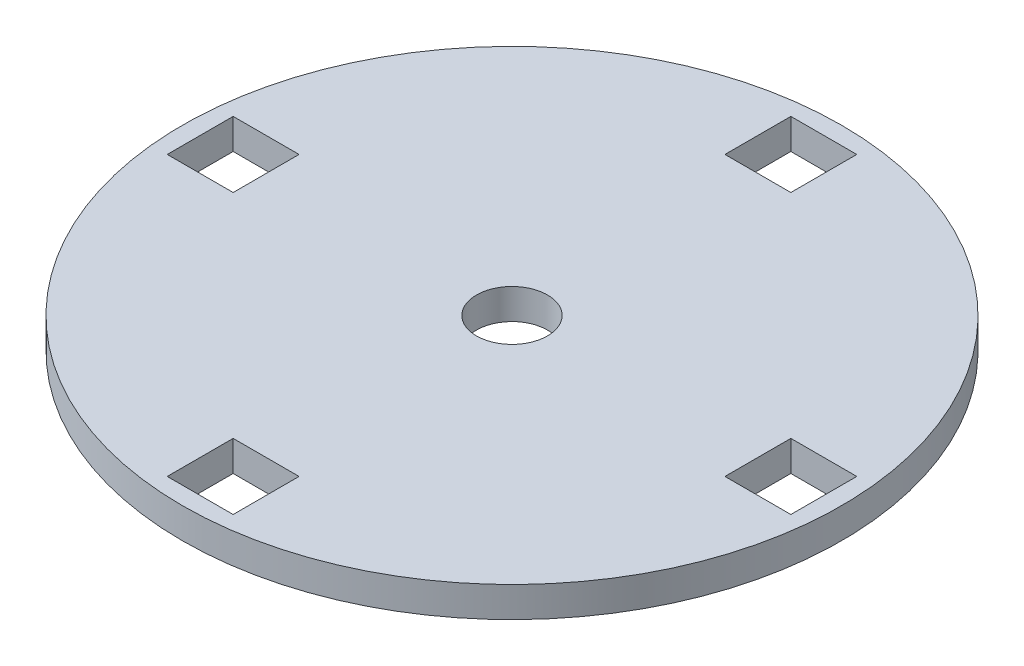
from build123d import *

# Parameters (mm, degrees)
SKETCH1_R               = 32.5
BOSS_EXTRUDE1_DEPTH     = 3
CUT_EXTRUDE1_DEPTH      = 10
CUT_EXTRUDE1_DEPTH_BACK = 47.059743812
SKETCH2_R               = 3.5
SKETCH2_W               = 6.5
SKETCH2_H               = 6.5


with BuildPart() as part:
    # Sketch1 → Boss-Extrude1 (new body)
    with BuildSketch(Plane(origin=(0, 0, 0), x_dir=(1, 0, 0), z_dir=(0, 1, 0))):
        with Locations(Location((0, 0, 0), (0, 0, 270))):
            Circle(SKETCH1_R)
    extrude(amount=BOSS_EXTRUDE1_DEPTH)

    # Sketch2 → Cut-Extrude1 (cut, two sides: drawn at the far end of the back side and taken through both)
    with BuildSketch(Plane(origin=(0, 0, 0), x_dir=(1, 0, 0), z_dir=(0, 1, 0)).offset(-CUT_EXTRUDE1_DEPTH_BACK)):
        with Locations(Location((0, 0, 0), (0, 0, 270))):
            Circle(SKETCH2_R)
        with Locations((0, -27.5)):
            Rectangle(SKETCH2_W, SKETCH2_H)
        with Locations((27.5, 0)):
            Rectangle(SKETCH2_W, SKETCH2_H)
        with Locations((-27.5, 0)):
            Rectangle(SKETCH2_W, SKETCH2_H)
        with Locations((0, 27.5)):
            Rectangle(SKETCH2_W, SKETCH2_H)
    extrude(amount=CUT_EXTRUDE1_DEPTH + CUT_EXTRUDE1_DEPTH_BACK, mode=Mode.SUBTRACT)


solid = part.part
